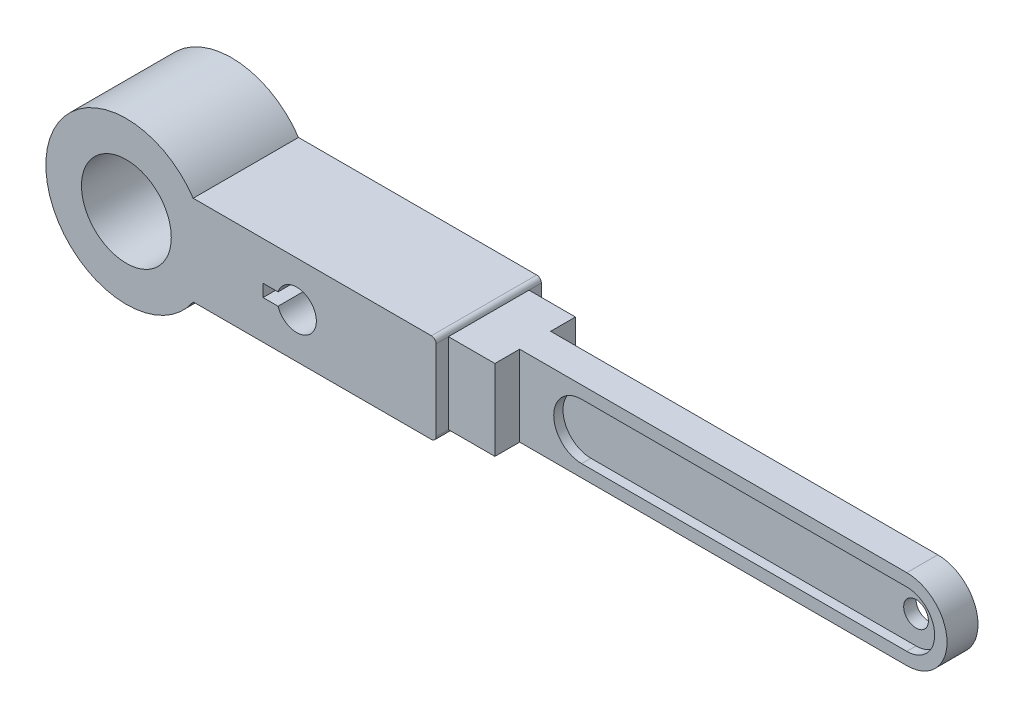
from build123d import *

# Parameters (mm, degrees)
ESBO_O1_R                = 14.5
RESSALTO_EXTRUS_O1_DEPTH = 17
ESBO_O1_4_R              = 14.5
ESBO_O1_4_R_2            = 4
RESSALTO_EXTRUS_O2_DEPTH = 13
RESSALTO_EXTRUS_O3_DEPTH = 5
ESBO_O1_9_R              = 4
RESSALTO_EXTRUS_O4_DEPTH = 2


with BuildPart() as part:
    # Esboço1 → Ressalto-extrusão1 (new, symmetric)
    with BuildSketch(Plane.XY):
        with BuildLine():
            ThreePointArc((-16.377431433, -13), (-16.816771262, -14.060660172), (-17.877431433, -14.5))
            Line((-17.877431433, -14.5), (-93.857447864, -14.5))
            Line((-93.857447864, -14.5), (-94.796189578, -14.5))
            ThreePointArc((-94.796189578, -14.5), (-142.377431433, 0), (-94.796189578, 14.5))
            Line((-94.796189578, 14.5), (-93.857447864, 14.5))
            Line((-93.857447864, 14.5), (-17.877431433, 14.5))
            ThreePointArc((-17.877431433, 14.5), (-16.816771262, 14.060660172), (-16.377431433, 13))
            Line((-16.377431433, 13), (-16.377431433, -13))
        make_face()
        with Locations((-116.377431433, 0)):
            Circle(ESBO_O1_R, mode=Mode.SUBTRACT)
        with BuildLine():
            ThreePointArc((-67.404246513, -2), (-55.027431433, 0), (-67.404246513, 2))
            Line((-67.404246513, 2), (-72.243354514, 2))
            Line((-72.243354514, 2), (-72.243354514, -2))
            Line((-72.243354514, -2), (-67.404246513, -2))
        make_face(mode=Mode.SUBTRACT)
    extrude(amount=RESSALTO_EXTRUS_O1_DEPTH, both=True)

    # Esboço1<4> → Ressalto-extrusão2 (add, symmetric)
    # profile 1 of 3: a face of its own
    with BuildSketch(Plane.XY):
        with BuildLine():
            Line((-17.877431433, 14.5), (-93.857447864, 14.5))
            Line((-93.857447864, 14.5), (-94.796189578, 14.5))
            ThreePointArc((-94.796189578, 14.5), (-142.377431433, 0), (-94.796189578, -14.5))
            Line((-94.796189578, -14.5), (-93.857447864, -14.5))
            Line((-93.857447864, -14.5), (-17.877431433, -14.5))
            ThreePointArc((-17.877431433, -14.5), (-16.816771262, -14.060660172), (-16.377431433, -13))
            Line((-16.377431433, -13), (-16.377431433, 13))
            ThreePointArc((-16.377431433, 13), (-16.816771262, 14.060660172), (-17.877431433, 14.5))
        make_face()
        with Locations((-116.377431433, 0)):
            Circle(ESBO_O1_4_R, mode=Mode.SUBTRACT)
        with BuildLine():
            ThreePointArc((-67.404246513, 2), (-55.027431433, 0), (-67.404246513, -2))
            Line((-67.404246513, -2), (-72.243354514, -2))
            Line((-72.243354514, -2), (-72.243354514, 2))
            Line((-72.243354514, 2), (-67.404246513, 2))
        make_face(mode=Mode.SUBTRACT)
    # profile 2 of 3: a face of its own
    with BuildSketch(Plane.XY):
        Polygon((-1.377431433, 13.000001379), (-16.377431433, 13), (-16.377431433, -13), (-1.377431433, -13), align=None)
    # profile 3 of 3: a face of its own
    with BuildSketch(Plane.XY):
        with Locations((123.619903756, 0)):
            Circle(ESBO_O1_4_R_2)
    extrude(amount=RESSALTO_EXTRUS_O2_DEPTH, both=True)


with BuildPart() as ressalto_extrus_o2_kept_piece:
    # of the separate pieces the step leaves, the one the design keeps (ressalto_extrus_o2_pieces_kept)
    add(part.part.solids().sort_by_distance((-16.377431433, -13, -17))[0])

    # Esboço1<8> → Ressalto-extrusão3 (add, symmetric)
    with BuildSketch(Plane.XY):
        with BuildLine():
            Line((123.625891638, -13), (-1.377431433, -13))
            Line((-1.377431433, -13), (-1.377431433, 13.000001379))
            Line((-1.377431433, 13.000001379), (123.619903756, 13.000001379))
            ThreePointArc((123.619903756, 13.000001379), (136.61990479, 0.002993941), (123.625891638, -13))
        make_face()
        with BuildLine():
            ThreePointArc((18.619903756, 9), (9.619903756, 0), (18.619903756, -9))
            Line((18.619903756, -9), (123.619903756, -9))
            ThreePointArc((123.619903756, -9), (132.619903756, 0), (123.619903756, 9))
            Line((123.619903756, 9), (18.619903756, 9))
        make_face(mode=Mode.SUBTRACT)
    extrude(amount=RESSALTO_EXTRUS_O3_DEPTH, both=True)

    # Esboço1<9> → Ressalto-extrusão4 (add, symmetric)
    with BuildSketch(Plane.XY):
        with BuildLine():
            Line((123.619903756, 9), (18.619903756, 9))
            ThreePointArc((18.619903756, 9), (9.619903756, 0), (18.619903756, -9))
            Line((18.619903756, -9), (123.619903756, -9))
            ThreePointArc((123.619903756, -9), (132.619903756, 0), (123.619903756, 9))
        make_face()
        with Locations((123.619903756, 0)):
            Circle(ESBO_O1_9_R, mode=Mode.SUBTRACT)
    extrude(amount=RESSALTO_EXTRUS_O4_DEPTH, both=True)


solid = ressalto_extrus_o2_kept_piece.part
